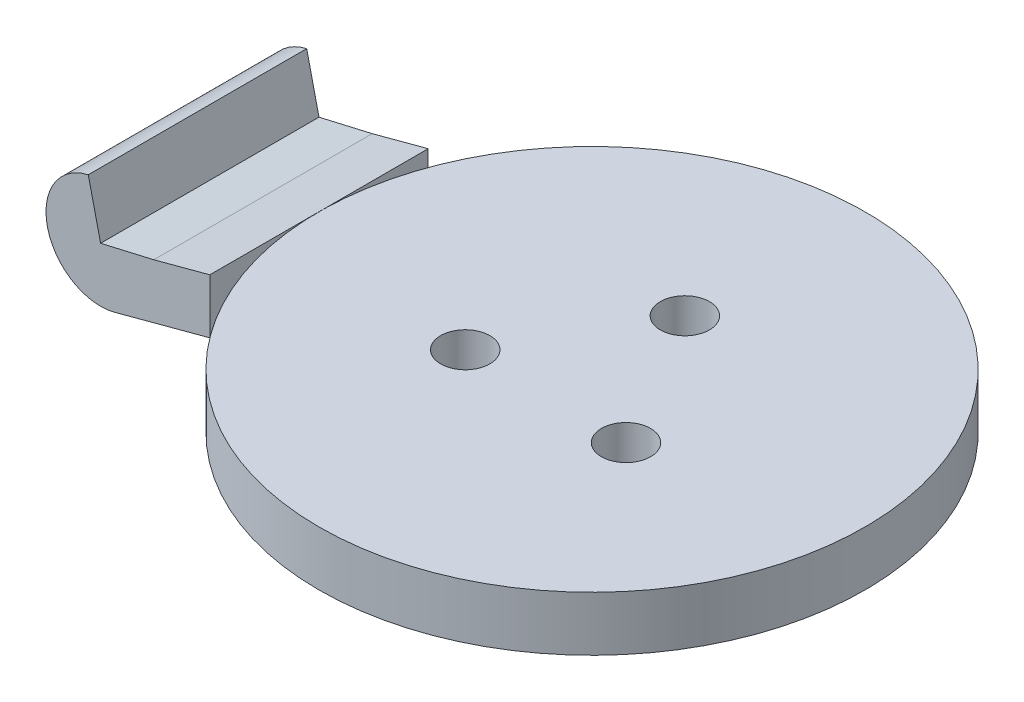
from build123d import *

# Parameters (mm, degrees)
SKETCH_1_R          = 25
SKETCH_1_R_2        = 2.25
EXTRUDE_1_DEPTH     = 2.5
SKETCH_4_R          = 5
EXTRUDE_2_DEPTH     = 10
EXTRUDE_3_DEPTH     = 20
CUT_EXTRUDE_1_DEPTH = 54.38539126


with BuildPart() as part:
    # Эскиз1 → Бобышка-Вытянуть1 (new, symmetric)
    with BuildSketch(Plane(origin=(0, 0, 0), x_dir=(1, 0, 0), z_dir=(0, 1, 0))):
        with Locations(Location((0, 0, 0), (0, 0, 270))):
            Circle(SKETCH_1_R)
        with Locations(Location((0, 8.5, 0), (0, 0, 270))):
            Circle(SKETCH_1_R_2, mode=Mode.SUBTRACT)
        with Locations(Location((7.361215932, -4.25, 0), (0, 0, 270))):
            Circle(SKETCH_1_R_2, mode=Mode.SUBTRACT)
        with Locations(Location((-7.361215932, -4.25, 0), (0, 0, 270))):
            Circle(SKETCH_1_R_2, mode=Mode.SUBTRACT)
    extrude(amount=EXTRUDE_1_DEPTH, both=True)


with BuildPart() as body_2:
    # Эскиз4 → Бобышка-Вытянуть2 (new, symmetric)
    with BuildSketch(Plane.XY):
        with Locations((-35, 0)):
            Circle(SKETCH_4_R)
    extrude(amount=EXTRUDE_2_DEPTH, both=True)

    # Эскиз5 → Бобышка-Вытянуть3 (add)
    with BuildSketch(Plane(origin=(0, 0, -10), x_dir=(-1, 0, 0), z_dir=(0, 0, -1))):
        Polygon((25, 2.5), (25, -2.5), (33.707515081, -4.830060324), (33.707515081, 0.169939676), align=None)
    extrude(amount=-EXTRUDE_3_DEPTH)

    # Эскиз6 → Вырез-Вытянуть1 (cut, through all)
    with BuildSketch(Plane(origin=(0, 0, -10), x_dir=(-1, 0, 0), z_dir=(0, 0, -1))):
        with BuildLine():
            ThreePointArc((36.1275744, 4.871198618), (32.352857929, 4.241773079), (30.128801382, 1.1275744))
            Line((30.128801382, 1.1275744), (35, 0))
            Line((35, 0), (36.1275744, 4.871198618))
        make_face()
    extrude(amount=-CUT_EXTRUDE_1_DEPTH, mode=Mode.SUBTRACT)


solid = Compound([part.part, body_2.part])
